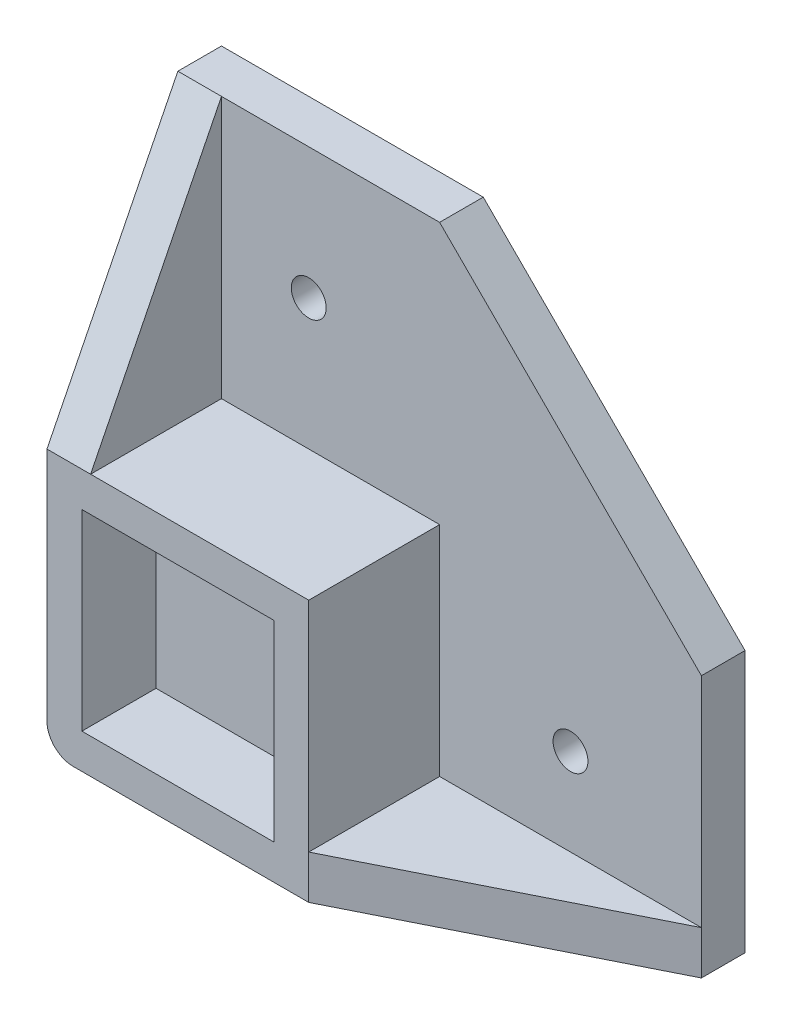
from build123d import *

# Parameters (mm, degrees)
DODANIE_WYCI_GNI_CIE1_DEPTH = 5
WYTNIJ_WYCI_GNI_CIE1_REACH  = 87
SZKIC2_R                    = 2
SZKIC3_W                    = 30
SZKIC3_H                    = 30
DODANIE_WYCI_GNI_CIE2_DEPTH = 15
DODANIE_WYCI_GNI_CIE3_DEPTH = 5
DODANIE_WYCI_GNI_CIE4_DEPTH = 5
ZAOKR_GLENIE1_R             = 3
SZKIC6_W                    = 22
SZKIC6_H                    = 22
WYTNIJ_WYCI_GNI_CIE2_DEPTH  = 8.5


with BuildPart() as part:
    # Szkic1 → Dodanie-wyciągnięcie1 (new body)
    with BuildSketch(Plane.XY):
        Polygon((0, 0), (0, 60), (30, 60), (60, 30), (60, 0), align=None)
    extrude(amount=DODANIE_WYCI_GNI_CIE1_DEPTH)

    # Szkic2 → Wytnij-wyciągnięcie1 (cut, up to next)
    with BuildSketch(Plane(origin=(0, 0, 0), x_dir=(-1, 0, 0), z_dir=(0, 0, -1)), mode=Mode.PRIVATE) as wytnij_wyci_gni_cie1_sk1:
        with Locations((-45, 15)):
            Circle(SZKIC2_R)
    wytnij_wyci_gni_cie1_tool1 = extrude(wytnij_wyci_gni_cie1_sk1.sketch, amount=-WYTNIJ_WYCI_GNI_CIE1_REACH, mode=Mode.PRIVATE) & part.part
    # Szkic2 → Wytnij-wyciągnięcie1 (cut, up to next)
    with BuildSketch(Plane(origin=(0, 0, 0), x_dir=(-1, 0, 0), z_dir=(0, 0, -1)), mode=Mode.PRIVATE) as wytnij_wyci_gni_cie1_sk2:
        with Locations((-15, 45)):
            Circle(SZKIC2_R)
    wytnij_wyci_gni_cie1_tool2 = extrude(wytnij_wyci_gni_cie1_sk2.sketch, amount=-WYTNIJ_WYCI_GNI_CIE1_REACH, mode=Mode.PRIVATE) & part.part
    add(wytnij_wyci_gni_cie1_tool1.solids().sort_by_distance((45, 15, 0))[0], mode=Mode.SUBTRACT)
    add(wytnij_wyci_gni_cie1_tool2.solids().sort_by_distance((15, 45, 0))[0], mode=Mode.SUBTRACT)

    # Szkic3 → Dodanie-wyciągnięcie2 (add)
    with BuildSketch(Plane.XY.offset(5)):
        with Locations((15, 15)):
            Rectangle(SZKIC3_W, SZKIC3_H)
    extrude(amount=DODANIE_WYCI_GNI_CIE2_DEPTH)

    # Szkic4 → Dodanie-wyciągnięcie3 (add)
    with BuildSketch(Plane(origin=(0, 0, 0), x_dir=(-1, 0, 0), z_dir=(0, -1, 0))):
        Polygon((-30, -5), (-30, -20), (-60, -5), align=None)
    extrude(amount=-DODANIE_WYCI_GNI_CIE3_DEPTH)

    # Szkic5 → Dodanie-wyciągnięcie4 (add)
    with BuildSketch(Plane.ZY):
        Polygon((5, 30), (20, 30), (5, 60), align=None)
    extrude(amount=-DODANIE_WYCI_GNI_CIE4_DEPTH)

    # Zaokrąglenie1
    zaokr_glenie1_edges = [part.edges().sort_by_distance(p)[0] for p in [
        (0, 0, 10),
    ]]
    fillet(zaokr_glenie1_edges, radius=ZAOKR_GLENIE1_R)

    # Szkic6 → Wytnij-wyciągnięcie2 (cut)
    with BuildSketch(Plane.XY.offset(20)):
        with Locations((15, 15)):
            Rectangle(SZKIC6_W, SZKIC6_H)
    extrude(amount=-WYTNIJ_WYCI_GNI_CIE2_DEPTH, mode=Mode.SUBTRACT)


solid = part.part
